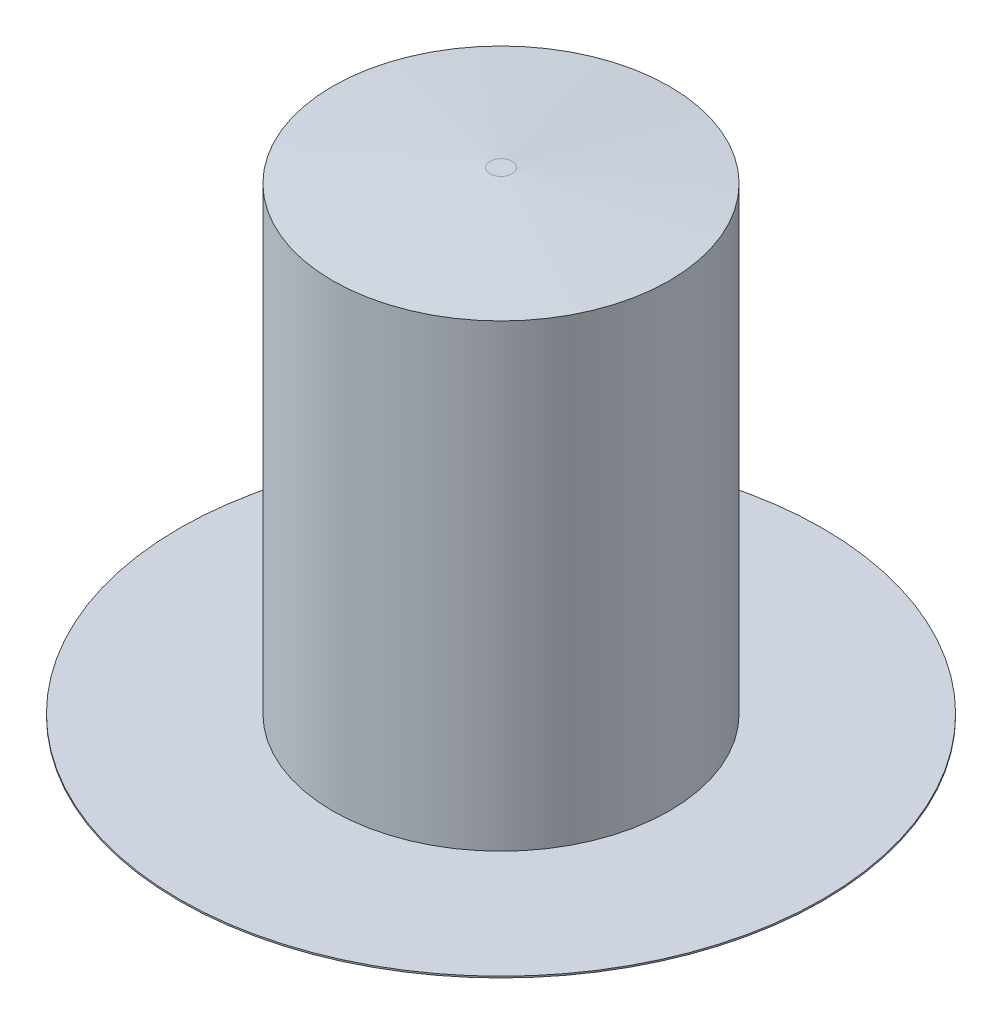
from build123d import *

# Parameters (mm, degrees)
SKETCH1_R           = 5.334
BOSS_EXTRUDE2_DEPTH = 0.0254
SKETCH2_R           = 2.794
BOSS_EXTRUDE4_DEPTH = 7.62
SKETCH3_R           = 2.794
BOSS_EXTRUDE5_DEPTH = 0.2286
BOSS_EXTRUDE5_TAPER = 84.999999999


with BuildPart() as part:
    # Sketch1 → Boss-Extrude2 (new body)
    with BuildSketch(Plane(origin=(0, 0, 0), x_dir=(1, 0, 0), z_dir=(0, 1, 0))):
        with Locations(Location((0, 0, 0), (0, 0, 270))):
            Circle(SKETCH1_R)
    extrude(amount=BOSS_EXTRUDE2_DEPTH)

    # Sketch2 → Boss-Extrude4 (add)
    with BuildSketch(Plane(origin=(0, 0.0254, 0), x_dir=(1, 0, 0), z_dir=(0, 1, 0))):
        with Locations(Location((0, 0, 0), (0, 0, 90))):
            Circle(SKETCH2_R)
    extrude(amount=BOSS_EXTRUDE4_DEPTH)

    # Sketch3 → Boss-Extrude5 (add)
    with BuildSketch(Plane(origin=(0, 7.6454, 0), x_dir=(1, 0, 0), z_dir=(0, 1, 0))):
        with Locations(Location((0, 0, 0), (0, 0, 90))):
            Circle(SKETCH3_R)
    extrude(amount=BOSS_EXTRUDE5_DEPTH, taper=BOSS_EXTRUDE5_TAPER)


solid = part.part
